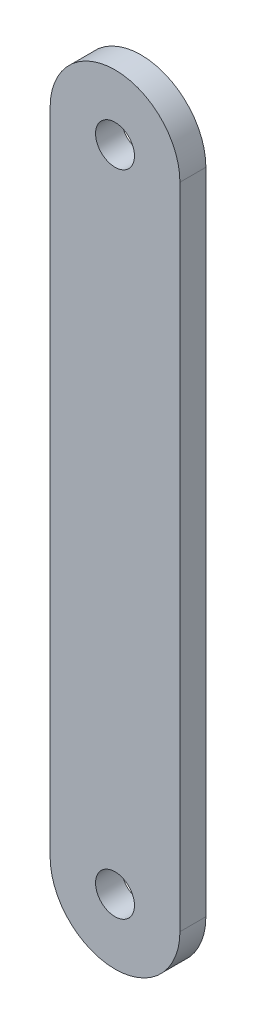
from build123d import *

# Parameters (mm, degrees)
SKETCH_1_R      = 1.5
EXTRUDE_1_DEPTH = 2


with BuildPart() as part:
    # 草图1 → 凸台-拉伸1 (new body)
    with BuildSketch(Plane.XY):
        with BuildLine():
            Line((-5, -25), (-5, 25))
            ThreePointArc((-5, 25), (0, 30), (5, 25))
            Line((5, 25), (5, -25))
            ThreePointArc((5, -25), (0, -30), (-5, -25))
        make_face()
        with Locations((0, 25)):
            Circle(SKETCH_1_R, mode=Mode.SUBTRACT)
        with Locations((0, -25)):
            Circle(SKETCH_1_R, mode=Mode.SUBTRACT)
    extrude(amount=EXTRUDE_1_DEPTH)


solid = part.part
